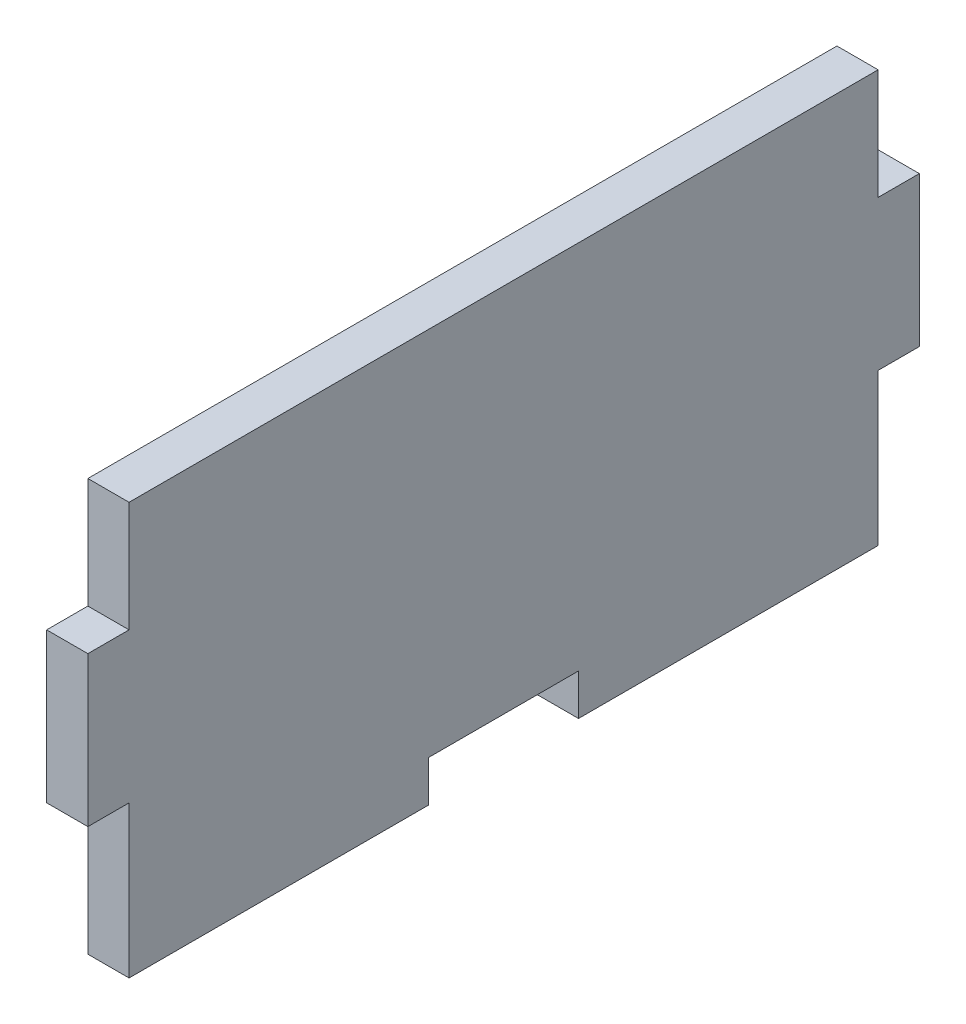
from build123d import *

# Parameters (mm, degrees)
BOSS_EXTRUDE1_DEPTH = 5.5


with BuildPart() as part:
    # Sketch1 → Boss-Extrude1 (new body)
    with BuildSketch(Plane(origin=(0, 0, 0), x_dir=(0, 0, -1), z_dir=(1, 0, 0))):
        Polygon((51.417768265, 0.037114876), (51.417768265, 5.537114876), (71.417768265, 5.537114876), (71.417768265, 0.037114876), (111.417768265, 0.037114876), (111.417768265, 20.287114876), (116.917768265, 20.287114876), (116.917768265, 40.287114876), (111.417768265, 40.287114876), (111.417768265, 55.037114876), (11.417768265, 55.037114876), (11.417768265, 40.287114876), (5.917768265, 40.287114876), (5.917768265, 20.287114876), (11.417768265, 20.287114876), (11.417768265, 0.037114876), align=None)
    extrude(amount=BOSS_EXTRUDE1_DEPTH)


solid = part.part
